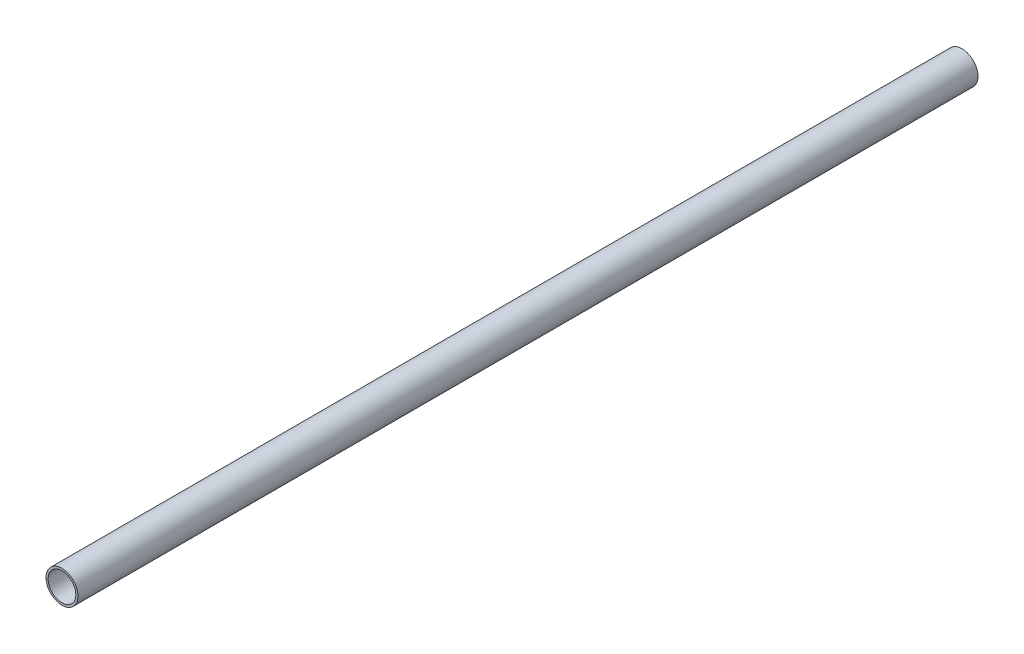
from build123d import *

# Parameters (mm, degrees)
SKETCH_1_R      = 7.5
SKETCH_1_R_2    = 6.5
EXTRUDE_1_DEPTH = 422


with BuildPart() as part:
    # 草图1 → 凸台-拉伸1 (new body)
    with BuildSketch(Plane.XY):
        Circle(SKETCH_1_R)
        Circle(SKETCH_1_R_2, mode=Mode.SUBTRACT)
    extrude(amount=EXTRUDE_1_DEPTH)


solid = part.part
